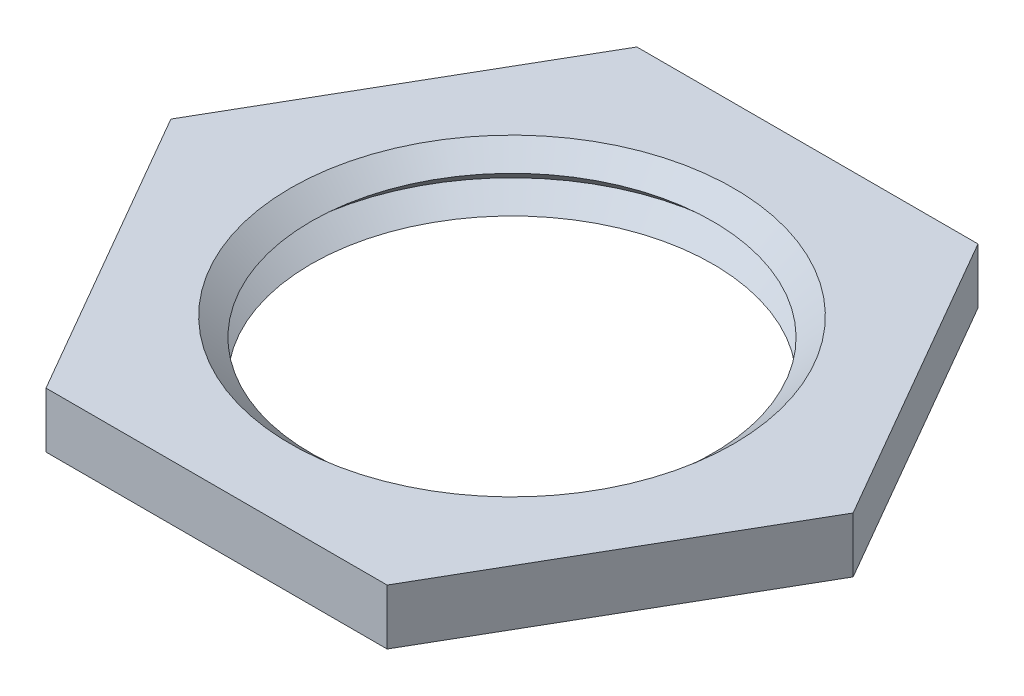
from build123d import *

# Parameters (mm, degrees)
SKETCH1_R           = 4.318
BOSS_EXTRUDE1_DEPTH = 1.191006


with BuildPart() as part:
    # Sketch1 → Boss-Extrude1 (new body)
    with BuildSketch(Plane(origin=(0, 0, 0), x_dir=(1, 0, 0), z_dir=(0, 1, 0))):
        Polygon((7.332348419, 0), (3.666174209, 6.35), (-3.666174209, 6.35), (-7.332348419, 0), (-3.666174209, -6.35), (3.666174209, -6.35), align=None)
        with Locations(Location((0, 0, 0), (0, 0, 270))):
            Circle(SKETCH1_R, mode=Mode.SUBTRACT)
    extrude(amount=BOSS_EXTRUDE1_DEPTH)

    # Sketch2 → Cut-Revolve1 (revolve, cut)
    with BuildSketch(Plane.XY, mode=Mode.PRIVATE) as cut_revolve1_sk:
        Polygon((4.7625, 1.191006), (4.318, 0.794004), (4.7625, 0.397002), (4.318, 0), (0, 0), (0, 1.191006), align=None)
    revolve(cut_revolve1_sk.sketch.rotate(Axis((0, 1.191006, 0), (0, -1, 0)), 180), axis=Axis((0, 1.191006, 0), (0, -1, 0)), mode=Mode.SUBTRACT)


solid = part.part
